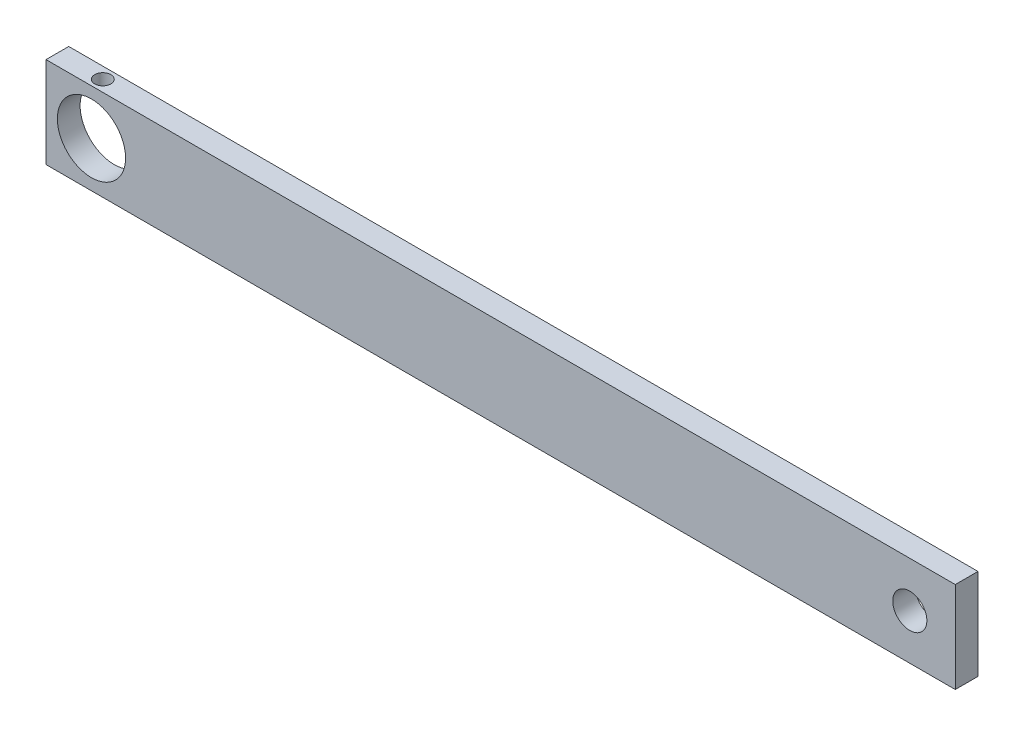
from build123d import *

# Parameters (mm, degrees)
SKETCH1_W           = 127
SKETCH1_H           = 12.7
SKETCH1_R           = 4.7625
SKETCH1_R_2         = 2.38125
BOSS_EXTRUDE1_DEPTH = 3.175
SKETCH2_R           = 1.1303
CUT_EXTRUDE1_DEPTH  = 6.35


with BuildPart() as part:
    # Sketch1 → Boss-Extrude1 (new body)
    with BuildSketch(Plane.XY):
        with Locations((63.5, 6.35)):
            Rectangle(SKETCH1_W, SKETCH1_H)
        with Locations((6.35, 6.35)):
            Circle(SKETCH1_R, mode=Mode.SUBTRACT)
        with Locations((120.65, 6.35)):
            Circle(SKETCH1_R_2, mode=Mode.SUBTRACT)
    extrude(amount=BOSS_EXTRUDE1_DEPTH)

    # Sketch2 → Cut-Extrude1 (cut)
    with BuildSketch(Plane(origin=(0, 12.7, 0), x_dir=(1, 0, 0), z_dir=(0, 1, 0))):
        with Locations(Location((6.35, -1.5875, 0), (0, 0, 270))):
            Circle(SKETCH2_R)
    extrude(amount=-CUT_EXTRUDE1_DEPTH, mode=Mode.SUBTRACT)


solid = part.part
